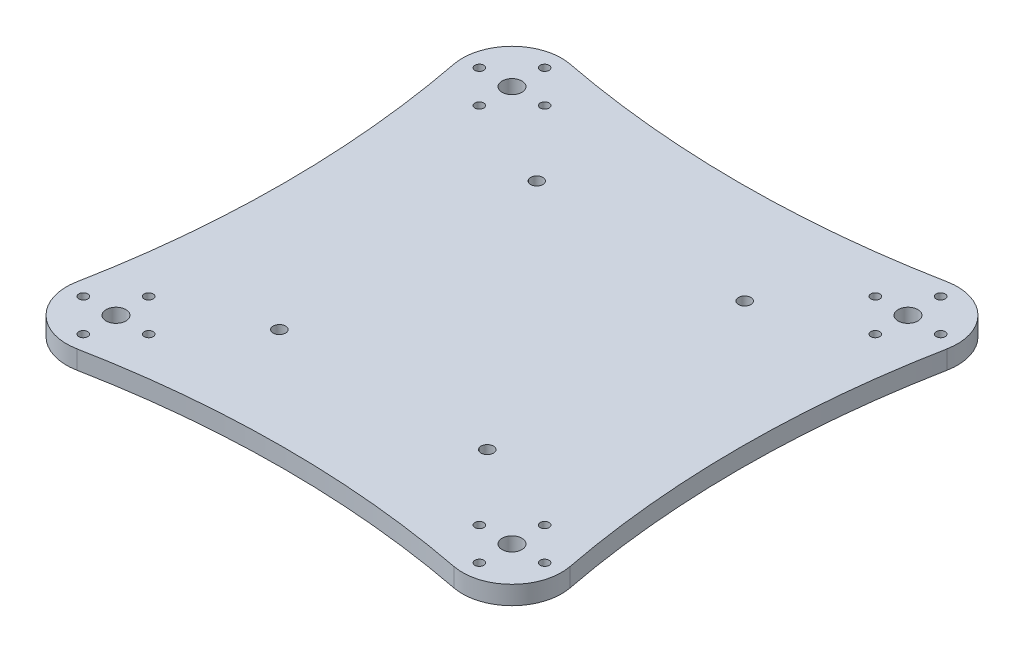
from build123d import *

# Parameters (mm, degrees)
SKETCH1_R           = 1.5875
BOSS_EXTRUDE1_DEPTH = 4.7625
SKETCH11_R          = 2.54
SKETCH11_R_2        = 1.143
CUT_EXTRUDE1_DEPTH  = 90.928757393


with BuildPart() as part:
    # Sketch1 → Boss-Extrude1 (new body)
    with BuildSketch(Plane(origin=(0, 0, 0), x_dir=(1, 0, 0), z_dir=(0, 1, 0))):
        with BuildLine():
            ThreePointArc((-48.380952381, 63.267486058), (-59.780256121, 59.780256121), (-63.267486058, 48.380952381))
            ThreePointArc((-63.267486058, 48.380952381), (-58.617207227, 0), (-63.267486058, -48.380952381))
            ThreePointArc((-63.267486058, -48.380952381), (-59.780256121, -59.780256121), (-48.380952381, -63.267486058))
            ThreePointArc((-48.380952381, -63.267486058), (0, -58.617207227), (48.380952381, -63.267486058))
            ThreePointArc((48.380952381, -63.267486058), (59.780256121, -59.780256121), (63.267486058, -48.380952381))
            ThreePointArc((63.267486058, -48.380952381), (58.617207227, 0), (63.267486058, 48.380952381))
            ThreePointArc((63.267486058, 48.380952381), (59.780256121, 59.780256121), (48.380952381, 63.267486058))
            ThreePointArc((48.380952381, 63.267486058), (0, 58.617207227), (-48.380952381, 63.267486058))
        make_face()
        with Locations(Location((-26.67, 33.02, 0), (0, 0, 90))):
            Circle(SKETCH1_R, mode=Mode.SUBTRACT)
        with Locations(Location((26.67, 33.02, 0), (0, 0, 90))):
            Circle(SKETCH1_R, mode=Mode.SUBTRACT)
        with Locations(Location((-26.67, -33.02, 0), (0, 0, 90))):
            Circle(SKETCH1_R, mode=Mode.SUBTRACT)
        with Locations(Location((26.67, -33.02, 0), (0, 0, 90))):
            Circle(SKETCH1_R, mode=Mode.SUBTRACT)
    extrude(amount=BOSS_EXTRUDE1_DEPTH)

    # Sketch11 → Cut-Extrude1 (cut, through all)
    with BuildSketch(Plane(origin=(0, 4.7625, 0), x_dir=(1, 0, 0), z_dir=(0, 1, 0))):
        with Locations(Location((-50.8, 50.8, 0), (0, 0, 270))):
            Circle(SKETCH11_R)
        with Locations(Location((-42.418, 50.8, 0), (0, 0, 270))):
            Circle(SKETCH11_R_2)
        with Locations(Location((-50.8, 42.418, 0), (0, 0, 270))):
            Circle(SKETCH11_R_2)
        with Locations(Location((-59.182, 50.8, 0), (0, 0, 270))):
            Circle(SKETCH11_R_2)
        with Locations(Location((-50.8, 59.182, 0), (0, 0, 270))):
            Circle(SKETCH11_R_2)
        with Locations(Location((50.8, 50.8, 0), (0, 0, 270))):
            Circle(SKETCH11_R)
        with Locations(Location((59.182, 50.8, 0), (0, 0, 270))):
            Circle(SKETCH11_R_2)
        with Locations(Location((50.8, 42.418, 0), (0, 0, 270))):
            Circle(SKETCH11_R_2)
        with Locations(Location((42.418, 50.8, 0), (0, 0, 270))):
            Circle(SKETCH11_R_2)
        with Locations(Location((50.8, 59.182, 0), (0, 0, 270))):
            Circle(SKETCH11_R_2)
        with Locations(Location((50.8, -50.8, 0), (0, 0, 270))):
            Circle(SKETCH11_R)
        with Locations(Location((59.182, -50.8, 0), (0, 0, 270))):
            Circle(SKETCH11_R_2)
        with Locations(Location((50.8, -59.182, 0), (0, 0, 270))):
            Circle(SKETCH11_R_2)
        with Locations(Location((42.418, -50.8, 0), (0, 0, 270))):
            Circle(SKETCH11_R_2)
        with Locations(Location((50.8, -42.418, 0), (0, 0, 270))):
            Circle(SKETCH11_R_2)
        with Locations(Location((-50.8, -50.8, 0), (0, 0, 270))):
            Circle(SKETCH11_R)
        with Locations(Location((-42.418, -50.8, 0), (0, 0, 270))):
            Circle(SKETCH11_R_2)
        with Locations(Location((-50.8, -59.182, 0), (0, 0, 270))):
            Circle(SKETCH11_R_2)
        with Locations(Location((-59.182, -50.8, 0), (0, 0, 270))):
            Circle(SKETCH11_R_2)
        with Locations(Location((-50.8, -42.418, 0), (0, 0, 270))):
            Circle(SKETCH11_R_2)
    extrude(amount=-CUT_EXTRUDE1_DEPTH, mode=Mode.SUBTRACT)


solid = part.part
